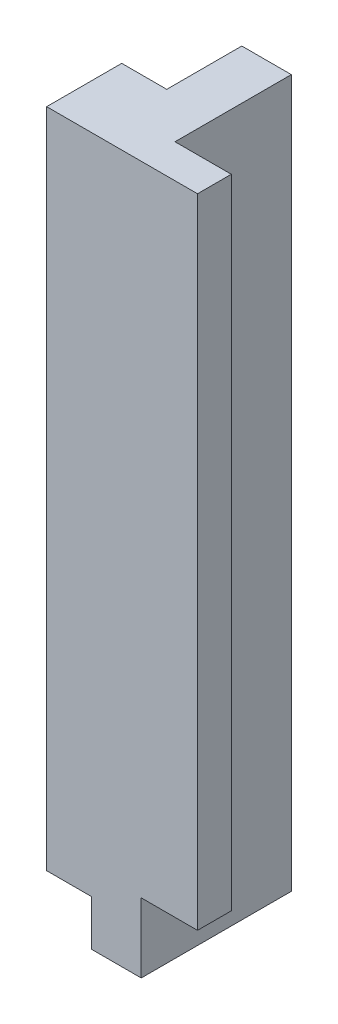
from build123d import *

# Parameters (mm, degrees)
SKETCH1_W           = 6.6
SKETCH1_H           = 20
BOSS_EXTRUDE1_DEPTH = 94.25
SKETCH3_W           = 10
SKETCH3_H           = 88.17
BOSS_EXTRUDE2_DEPTH = 6
SKETCH4_W           = 4.5
SKETCH4_H           = 85
BOSS_EXTRUDE3_DEPTH = 7.5


with BuildPart() as part:
    # Sketch1 → Boss-Extrude1 (new body)
    with BuildSketch(Plane(origin=(0, 0, 0), x_dir=(1, 0, 0), z_dir=(0, 1, 0))):
        with Locations((3.3, 10)):
            Rectangle(SKETCH1_W, SKETCH1_H)
    extrude(amount=BOSS_EXTRUDE1_DEPTH)

    # Sketch3 → Boss-Extrude2 (add)
    with BuildSketch(Plane.ZY):
        with Locations((-5, 50.165)):
            Rectangle(SKETCH3_W, SKETCH3_H)
    extrude(amount=BOSS_EXTRUDE2_DEPTH)

    # Sketch4 → Boss-Extrude3 (add)
    with BuildSketch(Plane(origin=(6.6, 0, 0), x_dir=(0, 0, -1), z_dir=(1, 0, 0))):
        with Locations((2.25, 51.75)):
            Rectangle(SKETCH4_W, SKETCH4_H)
    extrude(amount=BOSS_EXTRUDE3_DEPTH)


solid = part.part
